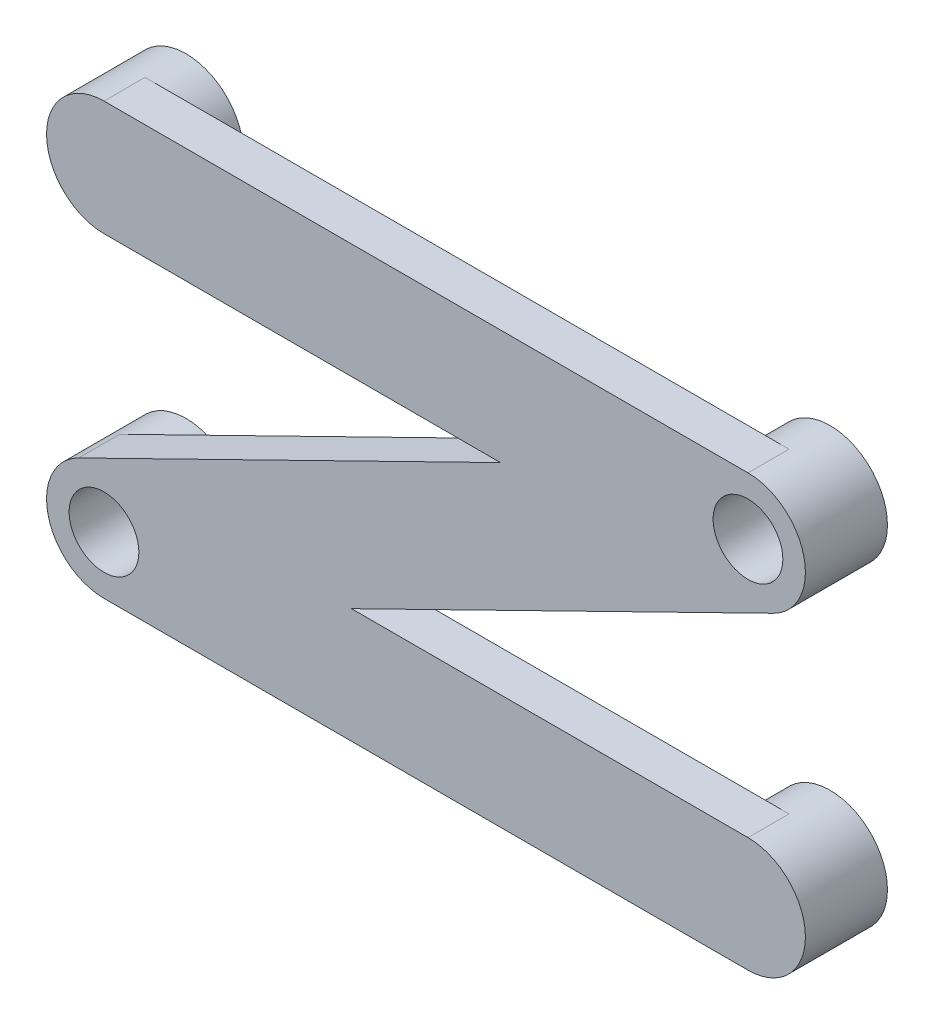
from build123d import *

# Parameters (mm, degrees)
EXTRUDE_1007_DEPTH = 2
SKETCH_1_5_R       = 2.8
SKETCH_1_5_R_2     = 1.7
EXTRUDE_1109_DEPTH = 4


with BuildPart() as part:
    # Эскиз1 → Extrude 1007 (new body)
    with BuildSketch(Plane.XY):
        with BuildLine():
            Line((15.7, 10.5), (-15.7, 10.5))
            ThreePointArc((-15.7, 10.5), (-13.720101013, 9.679898987), (-12.9, 7.7))
            ThreePointArc((-12.9, 7.7), (-13.720101013, 5.720101013), (-15.7, 4.9))
            Line((-15.7, 4.9), (3.632157719, 4.9))
            Line((3.632157719, 4.9), (-16.932946461, -5.186070203))
            ThreePointArc((-16.932946461, -5.186070203), (-14.218826494, -5.323842378), (-12.9, -7.7))
            ThreePointArc((-12.9, -7.7), (-13.720101013, -9.679898987), (-15.7, -10.5))
            Line((-15.7, -10.5), (15.7, -10.5))
            ThreePointArc((15.7, -10.5), (12.9, -7.7), (15.7, -4.9))
            Line((15.7, -4.9), (-3.632157719, -4.9))
            Line((-3.632157719, -4.9), (16.932946461, 5.186070203))
            ThreePointArc((16.932946461, 5.186070203), (12.972455002, 7.067150662), (15.7, 10.5))
        make_face()
    extrude(amount=-EXTRUDE_1007_DEPTH)

    # Эскиз1<5> → Extrude 1109 (add)
    # profile 1 of 4: a face of its own
    with BuildSketch(Plane.XY):
        with Locations((-15.7, 7.7)):
            Circle(SKETCH_1_5_R)
    # profile 2 of 4: a face of its own
    with BuildSketch(Plane.XY):
        with Locations((15.7, 7.7)):
            Circle(SKETCH_1_5_R)
        with Locations((15.7, 7.7)):
            Circle(SKETCH_1_5_R_2, mode=Mode.SUBTRACT)
    # profile 3 of 4: a face of its own
    with BuildSketch(Plane.XY):
        with Locations((-15.7, -7.7)):
            Circle(SKETCH_1_5_R)
        with Locations((-15.7, -7.7)):
            Circle(SKETCH_1_5_R_2, mode=Mode.SUBTRACT)
    # profile 4 of 4: a face of its own
    with BuildSketch(Plane.XY):
        with Locations((15.7, -7.7)):
            Circle(SKETCH_1_5_R)
    extrude(amount=-EXTRUDE_1109_DEPTH)


solid = part.part
